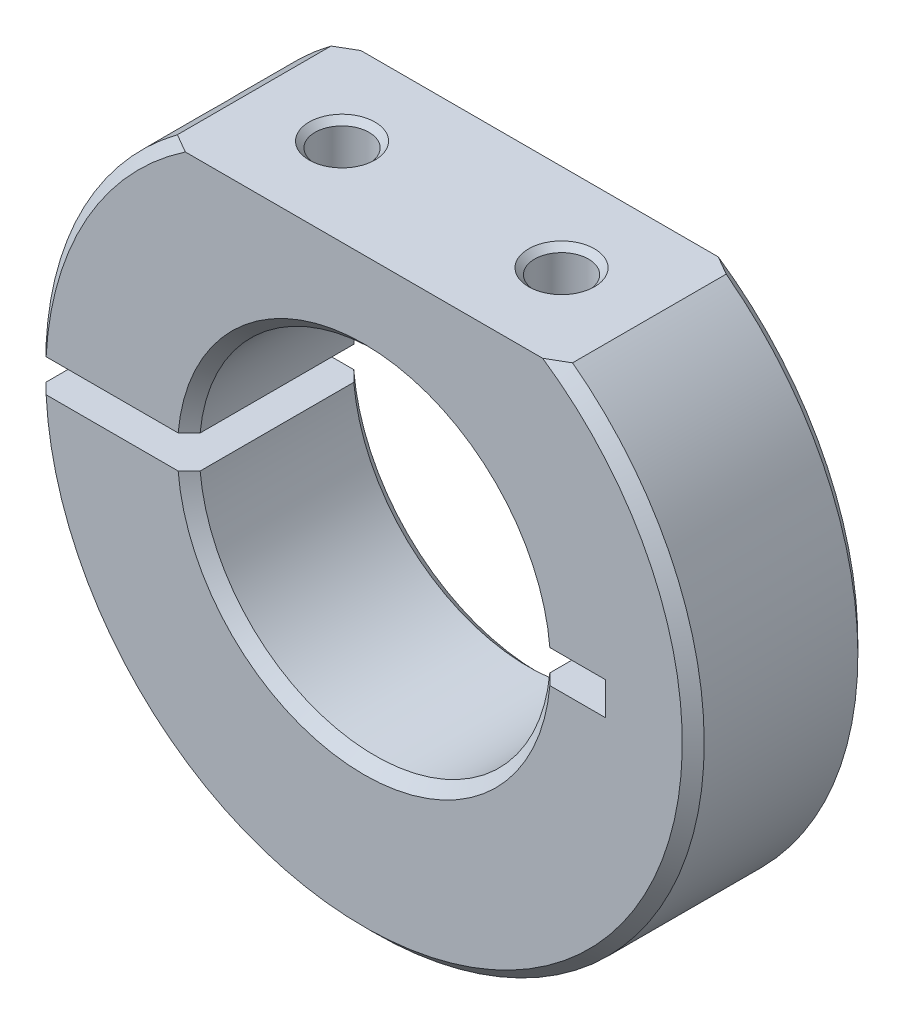
from build123d import *

# Parameters (mm, degrees)
CUT_EXTRUDE1_DEPTH      = 4
CUT_EXTRUDE1_DEPTH_BACK = 4
SKETCH2_W               = 41
SKETCH2_H               = 1.5
SKETCH4_W               = 1.2295
SKETCH4_H               = 15
CUT_EXTRUDE2_DEPTH      = 8
CUT_EXTRUDE2_DEPTH_BACK = 8
SKETCH5_W               = 30
SKETCH5_H               = 3.75


with BuildPart() as part:
    # Sketch1 → Revolve1 (revolve)
    with BuildSketch(Plane(origin=(0, 0, 0), x_dir=(0, 0, -1), z_dir=(1, 0, 0))):
        Polygon((-4, 8.5), (-3.5, 8), (3.5, 8), (4, 8.5), (4, 14.5), (3.5, 15), (-3.5, 15), (-4, 14.5), align=None)
    revolve(axis=Axis((0, 0, -4), (0, 0, 1)))

    # Sketch2 → Cut-Extrude1 (cut, two sides: drawn at the far end of the back side and taken through both)
    with BuildSketch(Plane.XY.offset(-CUT_EXTRUDE1_DEPTH_BACK)):
        with Locations((-9.5, 0)):
            Rectangle(SKETCH2_W, SKETCH2_H)
    extrude(amount=CUT_EXTRUDE1_DEPTH + CUT_EXTRUDE1_DEPTH_BACK, mode=Mode.SUBTRACT)

    # Sketch3 → Cut-Revolve1 (revolve, cut)
    with BuildSketch(Plane.XY):
        Polygon((-11.5, -15), (-14.5, -15), (-14.5, -3), (-13.2, -3), (-13.2, 0), (-11.5, 0), align=None)
    revolve(axis=Axis((-11.5, 0, 0), (0, -1, 0)), mode=Mode.SUBTRACT)

    # Sketch4 → Cut-Revolve2 (revolve, cut)
    with BuildSketch(Plane.XY):
        with Locations((-12.11475, 8.25)):
            Rectangle(SKETCH4_W, SKETCH4_H)
    revolve(axis=Axis((-11.5, 15.75, 0), (0, -1, 0)), mode=Mode.SUBTRACT)

    # Sketch5 → Cut-Extrude2 (cut, two sides: drawn at the far end of the back side and taken through both)
    with BuildSketch(Plane.XY.offset(-CUT_EXTRUDE2_DEPTH_BACK)):
        with Locations((0, 13.875)):
            Rectangle(SKETCH5_W, SKETCH5_H)
    extrude(amount=CUT_EXTRUDE2_DEPTH + CUT_EXTRUDE2_DEPTH_BACK, mode=Mode.SUBTRACT)

    # Sketch6 → Cut-Revolve3 (revolve, cut)
    with BuildSketch(Plane.XY):
        Polygon((-5, 2.333333333), (-6.2295, 2.333333333), (-6.2295, 11.7295), (-6.5, 12), (-5, 12), align=None)
    revolve(axis=Axis((-5, 12, 0), (0, -1, 0)), mode=Mode.SUBTRACT)

    # Sketch7 → Cut-Revolve4 (revolve, cut)
    with BuildSketch(Plane.XY):
        Polygon((5, 2.333333333), (3.7705, 2.333333333), (3.7705, 11.7295), (3.5, 12), (5, 12), align=None)
    revolve(axis=Axis((5, 12, 0), (0, -1, 0)), mode=Mode.SUBTRACT)


solid = part.part
